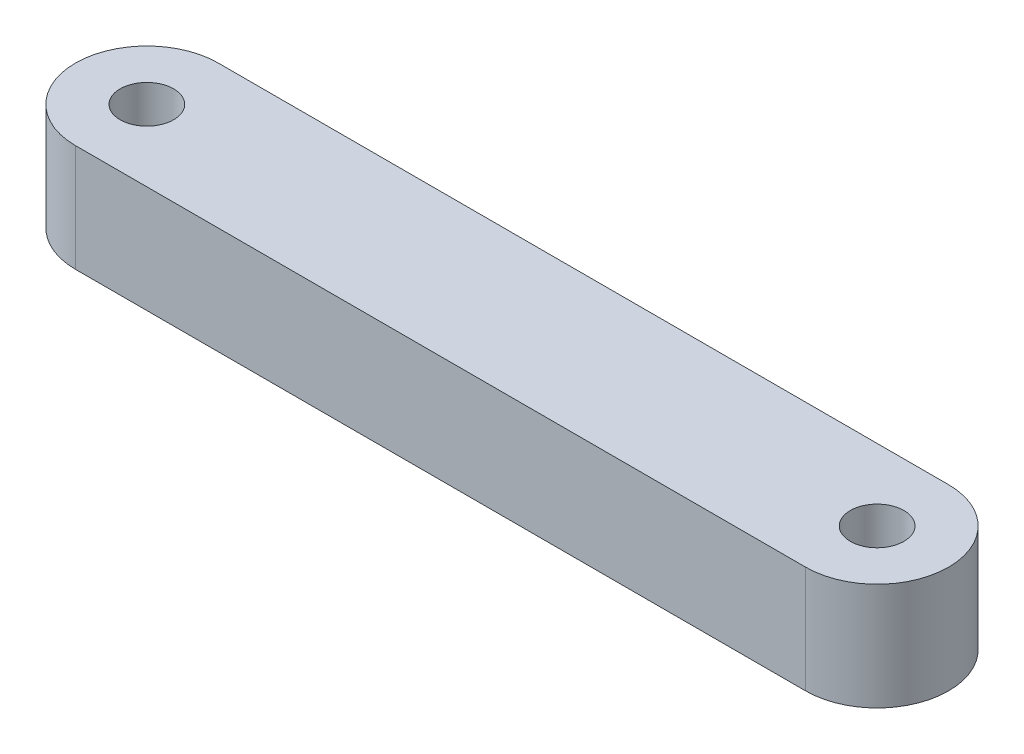
from build123d import *

# Parameters (mm, degrees)
SKETCH1_R           = 0.75
BOSS_EXTRUDE1_DEPTH = 3


with BuildPart() as part:
    # Sketch1 → Boss-Extrude1 (new body)
    with BuildSketch(Plane(origin=(0, 0, 0), x_dir=(1, 0, 0), z_dir=(0, 1, 0))):
        with BuildLine():
            Line((-10.22, 2), (10.22, 2))
            ThreePointArc((10.22, 2), (12.22, 0), (10.22, -2))
            Line((10.22, -2), (-10.22, -2))
            ThreePointArc((-10.22, -2), (-12.22, 0), (-10.22, 2))
        make_face()
        with Locations(Location((-10.22, 0, 0), (0, 0, 270))):
            Circle(SKETCH1_R, mode=Mode.SUBTRACT)
        with Locations(Location((10.22, 0, 0), (0, 0, 90))):
            Circle(SKETCH1_R, mode=Mode.SUBTRACT)
    extrude(amount=BOSS_EXTRUDE1_DEPTH)


solid = part.part
